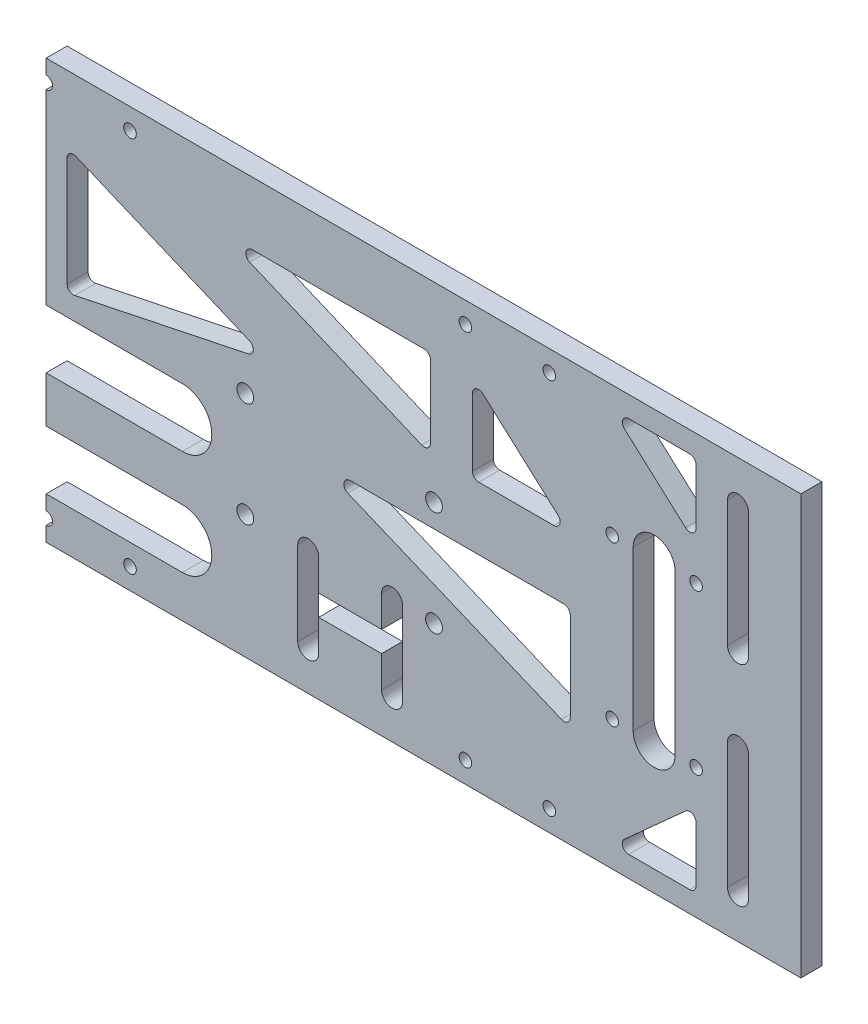
from build123d import *

# Parameters (mm, degrees)
SKETCH_1_W           = 320
SKETCH_1_H           = 121
EXTRUDE_1_DEPTH      = 5
SKETCH_2_W           = 5
SKETCH_2_H           = 30
CUT_EXTRUDE_1_DEPTH  = 343.14909031
SKETCH_3_R           = 1.5
CUT_EXTRUDE_2_DEPTH  = 343.14909031
SKETCH_4_R           = 1.5
CUT_EXTRUDE_3_DEPTH  = 343.14909031
SKETCH_6_R           = 2
CUT_EXTRUDE_5_DEPTH  = 343.14909031
SKETCH_5_W           = 250
SKETCH_5_H           = 30
CUT_EXTRUDE_4_DEPTH  = 343.14909031
SKETCH_7_W           = 260
SKETCH_7_H           = 30
EXTRUDE_2_DEPTH      = 5
SKETCH_8_W           = 320
SKETCH_8_H           = 21
CUT_EXTRUDE_6_DEPTH  = 5
SKETCH_9_W           = 15
SKETCH_9_H           = 100
EXTRUDE_3_DEPTH      = 5
CUT_EXTRUDE_7_DEPTH  = 5
CUT_EXTRUDE_8_DEPTH  = 5
SKETCH_15_R          = 1.5
CUT_EXTRUDE_9_DEPTH  = 357.217630108
SKETCH_16_W          = 5
SKETCH_16_H          = 19
CUT_EXTRUDE_10_DEPTH = 357.217630108
SKETCH_17_W          = 15
SKETCH_17_H          = 5
SKETCH_17_W_2        = 2.5
SKETCH_17_H_2        = 7.5
SKETCH_17_H_3        = 2.5
CUT_EXTRUDE_11_DEPTH = 357.217630108
SKETCH_18_W          = 5
SKETCH_18_H          = 100
EXTRUDE_4_DEPTH      = 5
SKETCH_19_W          = 180
SKETCH_19_H          = 100
CUT_EXTRUDE_12_DEPTH = 10
SKETCH_20_R          = 2
CUT_EXTRUDE_13_DEPTH = 10


with BuildPart() as part:
    # 草图1 → 凸台-拉伸1 (new body)
    with BuildSketch(Plane.XY):
        with Locations((160, 60.5)):
            Rectangle(SKETCH_1_W, SKETCH_1_H)
    extrude(amount=EXTRUDE_1_DEPTH)

    # 草图2 → 切除-拉伸1 (cut, through all)
    with BuildSketch(Plane.XY.offset(5)):
        with Locations((32.5, 15)):
            Rectangle(SKETCH_2_W, SKETCH_2_H)
        with Locations((287.5, 15)):
            Rectangle(SKETCH_2_W, SKETCH_2_H)
    extrude(amount=-CUT_EXTRUDE_1_DEPTH, mode=Mode.SUBTRACT)

    # 草图3 → 切除-拉伸2 (cut, through all)
    with BuildSketch(Plane.XY.offset(5)):
        with Locations((40, 116)):
            Circle(SKETCH_3_R)
        with Locations((60, 116)):
            Circle(SKETCH_3_R)
        with Locations((140, 116)):
            Circle(SKETCH_3_R)
        with Locations((160, 116)):
            Circle(SKETCH_3_R)
        with Locations(Location((260, 116, 0), (0, 0, 180))):
            Circle(SKETCH_3_R)
        with Locations(Location((280, 116, 0), (0, 0, 180))):
            Circle(SKETCH_3_R)
        with Locations(Location((180, 116, 0), (0, 0, 180))):
            Circle(SKETCH_3_R)
    extrude(amount=-CUT_EXTRUDE_2_DEPTH, mode=Mode.SUBTRACT)

    # 草图4 → 切除-拉伸3 (cut, through all)
    with BuildSketch(Plane.XY.offset(5)):
        with Locations((5, 90)):
            Circle(SKETCH_4_R)
        with Locations((25, 90)):
            Circle(SKETCH_4_R)
        with Locations((5, 10)):
            Circle(SKETCH_4_R)
        with Locations((25, 10)):
            Circle(SKETCH_4_R)
        with Locations(Location((295, 10, 0), (0, 0, 180))):
            Circle(SKETCH_4_R)
        with Locations(Location((315, 10, 0), (0, 0, 180))):
            Circle(SKETCH_4_R)
        with Locations(Location((295, 90, 0), (0, 0, 180))):
            Circle(SKETCH_4_R)
        with Locations(Location((315, 90, 0), (0, 0, 180))):
            Circle(SKETCH_4_R)
    extrude(amount=-CUT_EXTRUDE_3_DEPTH, mode=Mode.SUBTRACT)

    # 草图6 → 切除-拉伸5 (cut, through all)
    with BuildSketch(Plane.XY.offset(5)):
        with Locations((112.5, 75.5)):
            Circle(SKETCH_6_R)
        with Locations((207.5, 75.5)):
            Circle(SKETCH_6_R)
        with Locations((207.5, 50.5)):
            Circle(SKETCH_6_R)
        with Locations((112.5, 50.5)):
            Circle(SKETCH_6_R)
        with BuildLine():
            Line((127.5, 70), (192.5, 70))
            ThreePointArc((192.5, 70), (199.5, 63), (192.5, 56))
            Line((192.5, 56), (127.5, 56))
            ThreePointArc((127.5, 56), (120.5, 63), (127.5, 70))
        make_face()
    extrude(amount=-CUT_EXTRUDE_5_DEPTH, mode=Mode.SUBTRACT)

    # 草图5 → 切除-拉伸4 (cut, through all)
    with BuildSketch(Plane.XY.offset(5)):
        with BuildLine():
            Line((5, 101.368043607), (5, 114.5))
            ThreePointArc((5, 114.5), (5.439339828, 115.560660172), (6.5, 116))
            Line((6.5, 116), (21.091062659, 116))
            ThreePointArc((21.091062659, 116), (22.491493276, 115.037395651), (22.094509756, 113.385058781))
            Line((22.094509756, 113.385058781), (7.503447097, 100.253102388))
            ThreePointArc((7.503447097, 100.253102388), (5.889742123, 99.997793512), (5, 101.368043607))
        make_face()
        with BuildLine():
            Line((38.908937341, 85), (56.833333333, 85))
            ThreePointArc((56.833333333, 85), (57.893993505, 85.439339828), (58.333333333, 86.5))
            Line((58.333333333, 86.5), (58.333333333, 102.631956393))
            ThreePointArc((58.333333333, 102.631956393), (57.443591211, 104.002206488), (55.829886236, 103.746897612))
            Line((55.829886236, 103.746897612), (37.905490244, 87.614941219))
            ThreePointArc((37.905490244, 87.614941219), (37.508506724, 85.962604349), (38.908937341, 85))
        make_face()
        with BuildLine():
            Line((35, 68.5), (35, 47.25))
            ThreePointArc((35, 47.25), (35.667949706, 46.001924558), (37.076923077, 45.865384615))
            Line((37.076923077, 45.865384615), (88.076923077, 67.115384615))
            ThreePointArc((88.076923077, 67.115384615), (88.970871014, 68.794174203), (87.5, 70))
            Line((87.5, 70), (36.5, 70))
            ThreePointArc((36.5, 70), (35.439339828, 69.560660172), (35, 68.5))
        make_face()
        with Locations((160, 15)):
            Rectangle(SKETCH_5_W, SKETCH_5_H)
        with BuildLine():
            Line((68.333333333, 87.256929624), (68.333333333, 104.5))
            ThreePointArc((68.333333333, 104.5), (68.772673162, 105.560660172), (69.833333333, 106))
            Line((69.833333333, 106), (110.888262801, 106))
            ThreePointArc((110.888262801, 106), (112.358715068, 104.796260242), (111.469111528, 103.117026842))
            Line((111.469111528, 103.117026842), (70.41418206, 85.873956465))
            ThreePointArc((70.41418206, 85.873956465), (69.00305419, 86.007675228), (68.333333333, 87.256929624))
        make_face()
        with BuildLine():
            Line((111.788920254, 84.01540935), (153.193641955, 75.376872258))
            ThreePointArc((153.193641955, 75.376872258), (154.446166722, 75.68130869), (155, 76.845253935))
            Line((155, 76.845253935), (155, 102.873774141))
            ThreePointArc((155, 102.873774141), (154.330279143, 104.123028536), (152.919151273, 104.256747299))
            Line((152.919151273, 104.256747299), (111.514429572, 86.866764185))
            ThreePointArc((111.514429572, 86.866764185), (110.602180826, 85.340055375), (111.788920254, 84.01540935))
        make_face()
        with BuildLine():
            Line((167.080848727, 104.256747299), (208.485570428, 86.866764185))
            ThreePointArc((208.485570428, 86.866764185), (209.397819174, 85.340055375), (208.211079746, 84.01540935))
            Line((208.211079746, 84.01540935), (166.806358045, 75.376872258))
            ThreePointArc((166.806358045, 75.376872258), (165.553833278, 75.68130869), (165, 76.845253935))
            Line((165, 76.845253935), (165, 102.873774141))
            ThreePointArc((165, 102.873774141), (165.669720857, 104.123028536), (167.080848727, 104.256747299))
        make_face()
        with BuildLine():
            Line((208.530888472, 103.117026842), (249.58581794, 85.873956465))
            ThreePointArc((249.58581794, 85.873956465), (250.99694581, 86.007675228), (251.666666667, 87.256929624))
            Line((251.666666667, 87.256929624), (251.666666667, 104.5))
            ThreePointArc((251.666666667, 104.5), (251.227326838, 105.560660172), (250.166666667, 106))
            Line((250.166666667, 106), (209.111737199, 106))
            ThreePointArc((209.111737199, 106), (207.641284932, 104.796260242), (208.530888472, 103.117026842))
        make_face()
        with BuildLine():
            Line((232.5, 70), (283.5, 70))
            ThreePointArc((283.5, 70), (284.560660172, 69.560660172), (285, 68.5))
            Line((285, 68.5), (285, 47.25))
            ThreePointArc((285, 47.25), (284.332050294, 46.001924558), (282.923076923, 45.865384615))
            Line((282.923076923, 45.865384615), (231.923076923, 67.115384615))
            ThreePointArc((231.923076923, 67.115384615), (231.029128986, 68.794174203), (232.5, 70))
        make_face()
        with BuildLine():
            Line((264.170113764, 103.746897612), (282.094509756, 87.614941219))
            ThreePointArc((282.094509756, 87.614941219), (282.491493276, 85.962604349), (281.091062659, 85))
            Line((281.091062659, 85), (263.166666667, 85))
            ThreePointArc((263.166666667, 85), (262.106006495, 85.439339828), (261.666666667, 86.5))
            Line((261.666666667, 86.5), (261.666666667, 102.631956393))
            ThreePointArc((261.666666667, 102.631956393), (262.556408789, 104.002206488), (264.170113764, 103.746897612))
        make_face()
        with BuildLine():
            Line((297.905490244, 113.385058781), (312.496552903, 100.253102388))
            ThreePointArc((312.496552903, 100.253102388), (314.110257877, 99.997793512), (315, 101.368043607))
            Line((315, 101.368043607), (315, 114.5))
            ThreePointArc((315, 114.5), (314.560660172, 115.560660172), (313.5, 116))
            Line((313.5, 116), (298.908937341, 116))
            ThreePointArc((298.908937341, 116), (297.508506724, 115.037395651), (297.905490244, 113.385058781))
        make_face()
    extrude(amount=-CUT_EXTRUDE_4_DEPTH, mode=Mode.SUBTRACT)

    # 草图7 → 凸台-拉伸2 (add)
    with BuildSketch(Plane(origin=(0, 0, 0), x_dir=(-1, 0, 0), z_dir=(0, 0, -1))):
        with Locations((-160, 15)):
            Rectangle(SKETCH_7_W, SKETCH_7_H)
    extrude(amount=-EXTRUDE_2_DEPTH)

    # 草图8 → 切除-拉伸6 (cut)
    with BuildSketch(Plane(origin=(0, 0, 0), x_dir=(-1, 0, 0), z_dir=(0, 0, -1))):
        with Locations((-160, 10.5)):
            Rectangle(SKETCH_8_W, SKETCH_8_H)
    extrude(amount=-CUT_EXTRUDE_6_DEPTH, mode=Mode.SUBTRACT)

    # 草图9 → 凸台-拉伸3 (add)
    with BuildSketch(Plane(origin=(0, 0, 0), x_dir=(-1, 0, 0), z_dir=(0, 0, -1))):
        with Locations((-327.5, 71)):
            Rectangle(SKETCH_9_W, SKETCH_9_H)
        with Locations((7.5, 71)):
            Rectangle(SKETCH_9_W, SKETCH_9_H)
    extrude(amount=-EXTRUDE_3_DEPTH)

    # 草图10 → 切除-拉伸7 (cut)
    with BuildSketch(Plane(origin=(0, 0, 0), x_dir=(-1, 0, 0), z_dir=(0, 0, -1))):
        with BuildLine():
            Line((-325, 111), (-325, 81))
            Line((-325, 81), (-325, 78.5))
            ThreePointArc((-325, 78.5), (-323.232233047, 79.232233047), (-322.5, 81))
            Line((-322.5, 81), (-322.5, 111))
            ThreePointArc((-322.5, 111), (-323.232233047, 112.767766953), (-325, 113.5))
            Line((-325, 113.5), (-325, 111))
        make_face()
        with BuildLine():
            Line((-325, 78.5), (-325, 81))
            Line((-325, 81), (-325, 111))
            Line((-325, 111), (-325, 113.5))
            ThreePointArc((-325, 113.5), (-326.767766953, 112.767766953), (-327.5, 111))
            Line((-327.5, 111), (-327.5, 81))
            ThreePointArc((-327.5, 81), (-326.767766953, 79.232233047), (-325, 78.5))
        make_face()
        with BuildLine():
            ThreePointArc((-322.5, 61), (-323.232233047, 62.767766953), (-325, 63.5))
            Line((-325, 63.5), (-325, 61))
            Line((-325, 61), (-325, 31))
            Line((-325, 31), (-325, 28.5))
            ThreePointArc((-325, 28.5), (-323.232233047, 29.232233047), (-322.5, 31))
            Line((-322.5, 31), (-322.5, 61))
        make_face()
        with BuildLine():
            Line((-325, 61), (-325, 63.5))
            ThreePointArc((-325, 63.5), (-326.767766953, 62.767766953), (-327.5, 61))
            Line((-327.5, 61), (-327.5, 31))
            ThreePointArc((-327.5, 31), (-326.767766953, 29.232233047), (-325, 28.5))
            Line((-325, 28.5), (-325, 31))
            Line((-325, 31), (-325, 61))
        make_face()
        with BuildLine():
            Line((5, 113.5), (5, 78.5))
            ThreePointArc((5, 78.5), (6.767766953, 79.232233047), (7.5, 81))
            Line((7.5, 81), (7.5, 111))
            ThreePointArc((7.5, 111), (6.767766953, 112.767766953), (5, 113.5))
        make_face()
        with BuildLine():
            ThreePointArc((2.5, 81), (3.232233047, 79.232233047), (5, 78.5))
            Line((5, 78.5), (5, 113.5))
            ThreePointArc((5, 113.5), (3.232233047, 112.767766953), (2.5, 111))
            Line((2.5, 111), (2.5, 81))
        make_face()
        with BuildLine():
            ThreePointArc((7.5, 61), (6.767766953, 62.767766953), (5, 63.5))
            Line((5, 63.5), (5, 28.5))
            ThreePointArc((5, 28.5), (6.767766953, 29.232233047), (7.5, 31))
            Line((7.5, 31), (7.5, 61))
        make_face()
        with BuildLine():
            Line((5, 28.5), (5, 63.5))
            ThreePointArc((5, 63.5), (3.232233047, 62.767766953), (2.5, 61))
            Line((2.5, 61), (2.5, 31))
            ThreePointArc((2.5, 31), (3.232233047, 29.232233047), (5, 28.5))
        make_face()
    extrude(amount=-CUT_EXTRUDE_7_DEPTH, mode=Mode.SUBTRACT)

    # 草图13 → 切除-拉伸8 (cut)
    with BuildSketch(Plane(origin=(0, 0, 0), x_dir=(-1, 0, 0), z_dir=(0, 0, -1))):
        with BuildLine():
            Line((-192.5, 45), (-127.5, 45))
            ThreePointArc((-127.5, 45), (-120.5, 38), (-127.5, 31))
            Line((-127.5, 31), (-192.5, 31))
            ThreePointArc((-192.5, 31), (-199.5, 38), (-192.5, 45))
        make_face()
    extrude(amount=-CUT_EXTRUDE_8_DEPTH, mode=Mode.SUBTRACT)

    # 草图15 → 切除-拉伸9 (cut, through all)
    with BuildSketch(Plane(origin=(0, 0, 0), x_dir=(-1, 0, 0), z_dir=(0, 0, -1))):
        with Locations((-315, 52)):
            Circle(SKETCH_15_R)
        with BuildLine():
            ThreePointArc((-315, 40.631956393), (-314.110257877, 42.002206488), (-312.496552903, 41.746897612))
            Line((-312.496552903, 41.746897612), (-297.905490244, 28.614941219))
            ThreePointArc((-297.905490244, 28.614941219), (-297.508506724, 26.962604349), (-298.908937341, 26))
            Line((-298.908937341, 26), (-313.5, 26))
            ThreePointArc((-313.5, 26), (-314.560660172, 26.439339828), (-315, 27.5))
            Line((-315, 27.5), (-315, 40.631956393))
        make_face()
        with Locations((-295, 52)):
            Circle(SKETCH_15_R)
        with Locations((-280, 26)):
            Circle(SKETCH_15_R)
        with Locations((-260, 26)):
            Circle(SKETCH_15_R)
        with Locations((-180, 26)):
            Circle(SKETCH_15_R)
        with Locations((-160, 26)):
            Circle(SKETCH_15_R)
        with Locations((-140, 26)):
            Circle(SKETCH_15_R)
        with Locations((-60, 26)):
            Circle(SKETCH_15_R)
        with Locations((-40, 26)):
            Circle(SKETCH_15_R)
        with BuildLine():
            ThreePointArc((-21.091062659, 26), (-22.491493276, 26.962604349), (-22.094509756, 28.614941219))
            Line((-22.094509756, 28.614941219), (-7.503447097, 41.746897612))
            ThreePointArc((-7.503447097, 41.746897612), (-5.889742123, 42.002206488), (-5, 40.631956393))
            Line((-5, 40.631956393), (-5, 27.5))
            ThreePointArc((-5, 27.5), (-5.439339828, 26.439339828), (-6.5, 26))
            Line((-6.5, 26), (-21.091062659, 26))
        make_face()
        with Locations((-5, 52)):
            Circle(SKETCH_15_R)
        with Locations((-25, 52)):
            Circle(SKETCH_15_R)
    extrude(amount=-CUT_EXTRUDE_9_DEPTH, mode=Mode.SUBTRACT)

    # 草图16 → 切除-拉伸10 (cut, through all)
    with BuildSketch(Plane(origin=(0, 0, 0), x_dir=(-1, 0, 0), z_dir=(0, 0, -1))):
        with Locations((-302.5, 61.5)):
            Rectangle(SKETCH_16_W, SKETCH_16_H)
        with BuildLine():
            Line((-305, 52), (-310, 52))
            ThreePointArc((-310, 52), (-305, 47), (-300, 52))
            Line((-300, 52), (-305, 52))
        make_face()
        with Locations((-307.5, 61.5)):
            Rectangle(SKETCH_16_W, SKETCH_16_H)
        with Locations((-302.5, 80.5)):
            Rectangle(SKETCH_16_W, SKETCH_16_H)
        with Locations((-307.5, 80.5)):
            Rectangle(SKETCH_16_W, SKETCH_16_H)
        with BuildLine():
            ThreePointArc((-300, 90), (-305, 95), (-310, 90))
            Line((-310, 90), (-305, 90))
            Line((-305, 90), (-300, 90))
        make_face()
        with BuildLine():
            Line((-10, 71), (-20, 71))
            Line((-20, 71), (-20, 52))
            ThreePointArc((-20, 52), (-15, 47), (-10, 52))
            Line((-10, 52), (-10, 71))
        make_face()
        with BuildLine():
            Line((-20, 90), (-20, 71))
            Line((-20, 71), (-10, 71))
            Line((-10, 71), (-10, 90))
            ThreePointArc((-10, 90), (-15, 95), (-20, 90))
        make_face()
    extrude(amount=-CUT_EXTRUDE_10_DEPTH, mode=Mode.SUBTRACT)

    # 草图17 → 切除-拉伸11 (cut, through all)
    with BuildSketch(Plane(origin=(0, 0, 0), x_dir=(-1, 0, 0), z_dir=(0, 0, -1))):
        with BuildLine():
            Line((-77.5, 38), (-80, 38))
            Line((-80, 38), (-80, 30.5))
            ThreePointArc((-80, 30.5), (-77.5, 28), (-75, 30.5))
            Line((-75, 30.5), (-75, 40.5))
            ThreePointArc((-75, 40.5), (-75.732233047, 38.732233047), (-77.5, 38))
        make_face()
        with BuildLine():
            Line((-77.5, 43), (-80, 43))
            Line((-80, 43), (-80, 38))
            Line((-80, 38), (-77.5, 38))
            ThreePointArc((-77.5, 38), (-75.732233047, 38.732233047), (-75, 40.5))
            ThreePointArc((-75, 40.5), (-75.732233047, 42.267766953), (-77.5, 43))
        make_face()
        with BuildLine():
            Line((-80, 50.5), (-80, 43))
            Line((-80, 43), (-77.5, 43))
            ThreePointArc((-77.5, 43), (-75.732233047, 42.267766953), (-75, 40.5))
            Line((-75, 40.5), (-75, 50.5))
            ThreePointArc((-75, 50.5), (-77.5, 53), (-80, 50.5))
        make_face()
        with Locations((-87.5, 40.5)):
            Rectangle(SKETCH_17_W, SKETCH_17_H)
        with BuildLine():
            ThreePointArc((-97.5, 43), (-99.267766921, 42.267766985), (-100, 40.500000091))
            ThreePointArc((-100, 40.500000091), (-99.267766985, 38.732233079), (-97.5, 38))
            Line((-97.5, 38), (-95, 38))
            Line((-95, 38), (-95, 43))
            Line((-95, 43), (-97.5, 43))
        make_face()
        with BuildLine():
            ThreePointArc((-95, 50.5), (-97.5, 53), (-100, 50.5))
            Line((-100, 50.5), (-100, 40.500000091))
            ThreePointArc((-100, 40.500000091), (-99.267766921, 42.267766985), (-97.5, 43))
            Line((-97.5, 43), (-95, 43))
            Line((-95, 43), (-95, 50.5))
        make_face()
        with BuildLine():
            ThreePointArc((-97.5, 38), (-99.267766985, 38.732233079), (-100, 40.500000091))
            Line((-100, 40.500000091), (-100, 30.5))
            ThreePointArc((-100, 30.5), (-97.5, 28), (-95, 30.5))
            Line((-95, 30.5), (-95, 38))
            Line((-95, 38), (-97.5, 38))
        make_face()
        with Locations((-241.25, 46.75)):
            Rectangle(SKETCH_17_W_2, SKETCH_17_H_2)
        with BuildLine():
            Line((-242.5, 43), (-242.5, 50.5))
            Line((-242.5, 50.5), (-245, 50.5))
            Line((-245, 50.5), (-245, 40.5))
            ThreePointArc((-245, 40.5), (-244.267766953, 42.267766953), (-242.5, 43))
        make_face()
        with BuildLine():
            Line((-242.5, 50.5), (-240, 50.5))
            ThreePointArc((-240, 50.5), (-242.5, 53), (-245, 50.5))
            Line((-245, 50.5), (-242.5, 50.5))
        make_face()
        with Locations((-232.5, 41.75)):
            Rectangle(SKETCH_17_W, SKETCH_17_H_3)
        with Locations((-241.25, 41.75)):
            Rectangle(SKETCH_17_W_2, SKETCH_17_H_3)
        with BuildLine():
            Line((-242.5, 40.5), (-242.5, 43))
            ThreePointArc((-242.5, 43), (-244.267766953, 42.267766953), (-245, 40.5))
            Line((-245, 40.5), (-242.5, 40.5))
        make_face()
        with BuildLine():
            Line((-242.5, 40.5), (-245, 40.5))
            ThreePointArc((-245, 40.5), (-244.267766953, 38.732233047), (-242.5, 38))
            Line((-242.5, 38), (-242.5, 40.5))
        make_face()
        with Locations((-241.25, 39.25)):
            Rectangle(SKETCH_17_W_2, SKETCH_17_H_3)
        with Locations((-232.5, 39.25)):
            Rectangle(SKETCH_17_W, SKETCH_17_H_3)
        with Locations((-241.25, 34.25)):
            Rectangle(SKETCH_17_W_2, SKETCH_17_H_2)
        with BuildLine():
            ThreePointArc((-242.5, 38), (-244.267766953, 38.732233047), (-245, 40.5))
            Line((-245, 40.5), (-245, 30.5))
            Line((-245, 30.5), (-242.5, 30.5))
            Line((-242.5, 30.5), (-242.5, 38))
        make_face()
        with BuildLine():
            ThreePointArc((-245, 30.5), (-242.5, 28), (-240, 30.5))
            Line((-240, 30.5), (-242.5, 30.5))
            Line((-242.5, 30.5), (-245, 30.5))
        make_face()
        with BuildLine():
            ThreePointArc((-225, 30.5), (-222.5, 28), (-220, 30.5))
            Line((-220, 30.5), (-222.5, 30.5))
            Line((-222.5, 30.5), (-225, 30.5))
        make_face()
        with BuildLine():
            Line((-220, 30.5), (-220, 40.5))
            ThreePointArc((-220, 40.5), (-220.732233047, 38.732233047), (-222.5, 38))
            Line((-222.5, 38), (-222.5, 30.5))
            Line((-222.5, 30.5), (-220, 30.5))
        make_face()
        with Locations((-223.75, 34.25)):
            Rectangle(SKETCH_17_W_2, SKETCH_17_H_2)
        with Locations((-223.75, 39.25)):
            Rectangle(SKETCH_17_W_2, SKETCH_17_H_3)
        with BuildLine():
            ThreePointArc((-222.5, 38), (-220.732233047, 38.732233047), (-220, 40.5))
            Line((-220, 40.5), (-222.5, 40.5))
            Line((-222.5, 40.5), (-222.5, 38))
        make_face()
        with BuildLine():
            Line((-222.5, 40.5), (-220, 40.5))
            ThreePointArc((-220, 40.5), (-220.732233047, 42.267766953), (-222.5, 43))
            Line((-222.5, 43), (-222.5, 40.5))
        make_face()
        with Locations((-223.75, 41.75)):
            Rectangle(SKETCH_17_W_2, SKETCH_17_H_3)
        with Locations((-223.75, 46.75)):
            Rectangle(SKETCH_17_W_2, SKETCH_17_H_2)
        with BuildLine():
            Line((-220, 40.5), (-220, 50.5))
            Line((-220, 50.5), (-222.5, 50.5))
            Line((-222.5, 50.5), (-222.5, 43))
            ThreePointArc((-222.5, 43), (-220.732233047, 42.267766953), (-220, 40.5))
        make_face()
        with BuildLine():
            Line((-222.5, 50.5), (-220, 50.5))
            ThreePointArc((-220, 50.5), (-222.5, 53), (-225, 50.5))
            Line((-225, 50.5), (-222.5, 50.5))
        make_face()
    extrude(amount=-CUT_EXTRUDE_11_DEPTH, mode=Mode.SUBTRACT)

    # 草图18 → 凸台-拉伸4 (add)
    with BuildSketch(Plane(origin=(0, 0, 0), x_dir=(-1, 0, 0), z_dir=(0, 0, -1))):
        with Locations((-337.5, 71)):
            Rectangle(SKETCH_18_W, SKETCH_18_H)
        with Locations((17.5, 71)):
            Rectangle(SKETCH_18_W, SKETCH_18_H)
    extrude(amount=-EXTRUDE_4_DEPTH)

    # 草图19 → 切除-拉伸12 (cut)
    with BuildSketch(Plane.XY.offset(5)):
        with Locations((70, 71)):
            Rectangle(SKETCH_19_W, SKETCH_19_H)
    extrude(amount=-CUT_EXTRUDE_12_DEPTH, mode=Mode.SUBTRACT)

    # 草图20 → 切除-拉伸13 (cut)
    with BuildSketch(Plane.XY.offset(5)):
        with Locations((252.5, 75.5)):
            Circle(SKETCH_20_R)
        with Locations((252.5, 50.5)):
            Circle(SKETCH_20_R)
    extrude(amount=-CUT_EXTRUDE_13_DEPTH, mode=Mode.SUBTRACT)


solid = part.part
